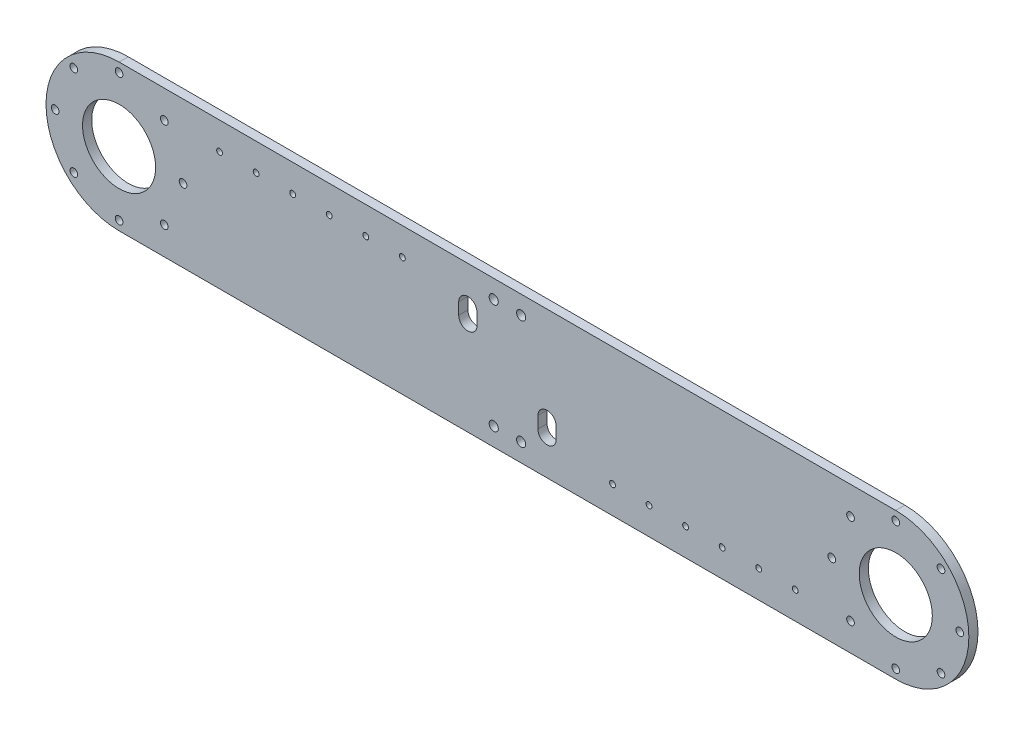
from build123d import *

# Parameters (mm, degrees)
EXTRUDE_1_DEPTH     = 5
SKETCH_2_R          = 2.5
CUT_EXTRUDE_1_DEPTH = 10
SKETCH_3_R          = 20
CUT_EXTRUDE_2_DEPTH = 256.697575272
CUT_EXTRUDE_3_DEPTH = 256.697575272
SKETCH_5_R          = 1.6
CUT_EXTRUDE_4_DEPTH = 256.697575272
SKETCH_6_R          = 2.1
CUT_EXTRUDE_5_DEPTH = 256.697575272


with BuildPart() as part:
    # 草图1 → 凸台-拉伸1 (new body)
    with BuildSketch(Plane.XY):
        with BuildLine():
            Line((-212.5, 40), (212.5, 40))
            ThreePointArc((212.5, 40), (252.5, 0), (212.5, -40))
            Line((212.5, -40), (-212.5, -40))
            ThreePointArc((-212.5, -40), (-252.5, 0), (-212.5, 40))
        make_face()
    extrude(amount=EXTRUDE_1_DEPTH)

    # 草图2 → 切除-拉伸1 (cut)
    with BuildSketch(Plane.XY.offset(5)):
        with Locations((-7.5, 30)):
            Circle(SKETCH_2_R)
        with Locations((7.5, 30)):
            Circle(SKETCH_2_R)
        with Locations((7.5, -30)):
            Circle(SKETCH_2_R)
        with Locations((-7.5, -30)):
            Circle(SKETCH_2_R)
    extrude(amount=-CUT_EXTRUDE_1_DEPTH, mode=Mode.SUBTRACT)

    # 草图3 → 切除-拉伸2 (cut, through all)
    with BuildSketch(Plane.XY.offset(5)):
        with Locations((-212.5, 0)):
            Circle(SKETCH_3_R)
        with Locations((212.5, 0)):
            Circle(SKETCH_3_R)
    extrude(amount=-CUT_EXTRUDE_2_DEPTH, mode=Mode.SUBTRACT)

    # 草图4 → 切除-拉伸3 (cut, through all)
    with BuildSketch(Plane(origin=(0, 0, 0), x_dir=(-1, 0, 0), z_dir=(0, 0, -1))):
        with BuildLine():
            Line((-16.665194888, -12.934457925), (-16.665194888, -19.318378476))
            ThreePointArc((-16.665194888, -19.318378476), (-21.665194888, -24.318378476), (-26.665194888, -19.318378476))
            Line((-26.665194888, -19.318378476), (-26.665194888, -12.934457925))
            ThreePointArc((-26.665194888, -12.934457925), (-21.665194888, -7.934457925), (-16.665194888, -12.934457925))
        make_face()
        with BuildLine():
            Line((26.665194888, 19.318378476), (26.665194888, 12.934457925))
            ThreePointArc((26.665194888, 12.934457925), (21.665194888, 7.934457925), (16.665194888, 12.934457925))
            Line((16.665194888, 12.934457925), (16.665194888, 19.318378476))
            ThreePointArc((16.665194888, 19.318378476), (21.665194888, 24.318378476), (26.665194888, 19.318378476))
        make_face()
    extrude(amount=-CUT_EXTRUDE_3_DEPTH, mode=Mode.SUBTRACT)

    # 草图5 → 切除-拉伸4 (cut, through all)
    with BuildSketch(Plane.XY.offset(5)):
        with Locations((57.5, -25)):
            Circle(SKETCH_5_R)
        with Locations((77.5, -25)):
            Circle(SKETCH_5_R)
        with Locations((97.5, -25)):
            Circle(SKETCH_5_R)
        with Locations((117.5, -25)):
            Circle(SKETCH_5_R)
        with Locations((137.5, -25)):
            Circle(SKETCH_5_R)
        with Locations((157.5, -25)):
            Circle(SKETCH_5_R)
        with Locations((-57.5, 25)):
            Circle(SKETCH_5_R)
        with Locations((-77.5, 25)):
            Circle(SKETCH_5_R)
        with Locations((-97.5, 25)):
            Circle(SKETCH_5_R)
        with Locations((-117.5, 25)):
            Circle(SKETCH_5_R)
        with Locations((-137.5, 25)):
            Circle(SKETCH_5_R)
        with Locations((-157.5, 25)):
            Circle(SKETCH_5_R)
    extrude(amount=-CUT_EXTRUDE_4_DEPTH, mode=Mode.SUBTRACT)

    # 草图6 → 切除-拉伸5 (cut, through all)
    with BuildSketch(Plane(origin=(0, 0, 0), x_dir=(-1, 0, 0), z_dir=(0, 0, -1))):
        with Locations((-247.5, 0)):
            Circle(SKETCH_6_R)
        with Locations((-237.248737342, 24.748737342)):
            Circle(SKETCH_6_R)
        with Locations((-212.5, 35)):
            Circle(SKETCH_6_R)
        with Locations((-187.751262658, 24.748737342)):
            Circle(SKETCH_6_R)
        with Locations((-177.5, 0)):
            Circle(SKETCH_6_R)
        with Locations((-187.751262658, -24.748737342)):
            Circle(SKETCH_6_R)
        with Locations((-212.5, -35)):
            Circle(SKETCH_6_R)
        with Locations((-237.248737342, -24.748737342)):
            Circle(SKETCH_6_R)
    cut_extrude_5 = extrude(amount=-CUT_EXTRUDE_5_DEPTH, mode=Mode.SUBTRACT)

    # 镜向1: 切除-拉伸5 across plane
    add(cut_extrude_5.mirror(Plane(origin=(0, 0, 0), x_dir=(0, 0, 1), z_dir=(1, 0, 0))), mode=Mode.SUBTRACT)


solid = part.part
